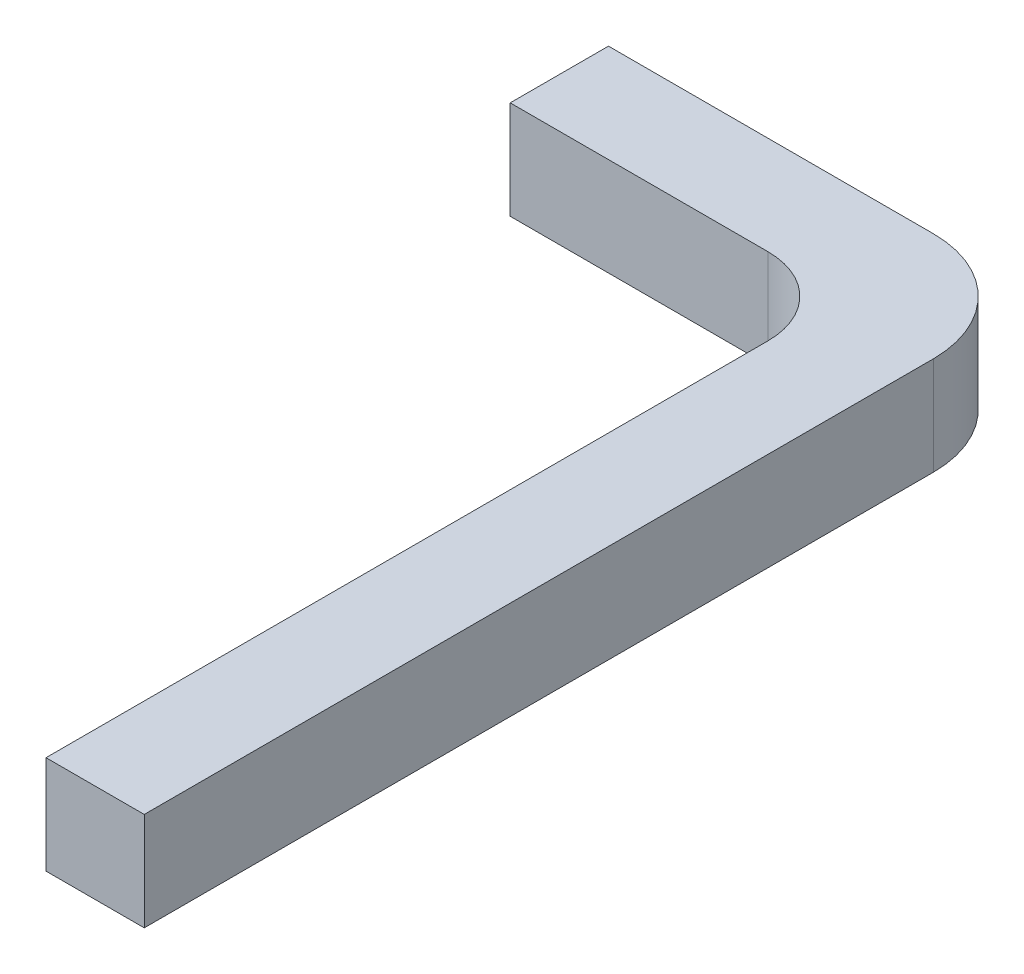
from build123d import *

# Parameters (mm, degrees)
SKETCH9_W           = 21.65
SKETCH9_H           = 6.35
SKETCH9_W_2         = 6.35
SKETCH9_H_2         = 51.65
BOSS_EXTRUDE1_DEPTH = 6.35
FILLET2_R           = 5
FILLET3_R           = 7


with BuildPart() as part:
    # Sketch9 → Boss-Extrude1 (new body)
    with BuildSketch(Plane(origin=(0, 0, 0), x_dir=(1, 0, 0), z_dir=(0, 1, 0))):
        with Locations((10.825, -3.175)):
            Rectangle(SKETCH9_W, SKETCH9_H)
        with Locations((24.825, -3.175)):
            Rectangle(SKETCH9_W_2, SKETCH9_H)
        with Locations((24.825, -32.175)):
            Rectangle(SKETCH9_W_2, SKETCH9_H_2)
    extrude(amount=BOSS_EXTRUDE1_DEPTH)

    # Fillet2
    fillet2_edges = [part.edges().sort_by_distance(p)[0] for p in [
        (21.65, 3.175, 6.35),
    ]]
    fillet(fillet2_edges, radius=FILLET2_R)

    # Fillet3
    fillet3_edges = [part.edges().sort_by_distance(p)[0] for p in [
        (28, 3.175, 0),
    ]]
    fillet(fillet3_edges, radius=FILLET3_R)


solid = part.part
